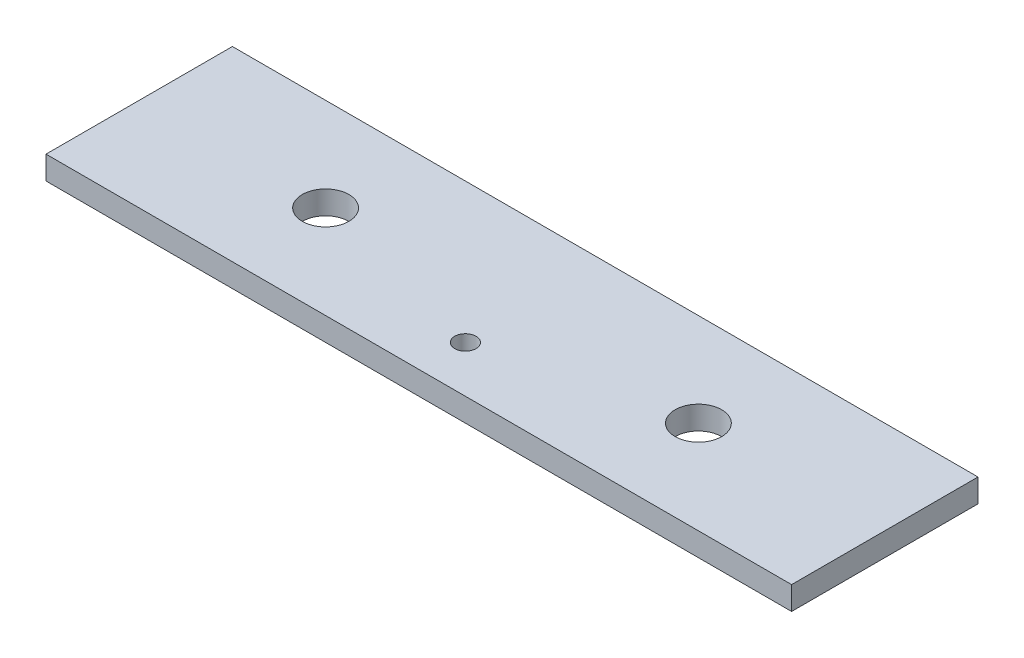
from build123d import *

# Parameters (mm, degrees)
SKETCH1_W           = 101.6
SKETCH1_H           = 25.4
BOSS_EXTRUDE1_DEPTH = 3.175
SKETCH2_R           = 1.4605
SKETCH2_R_2         = 3.175
CUT_EXTRUDE1_DEPTH  = 105.775


with BuildPart() as part:
    # Sketch1 → Boss-Extrude1 (new body)
    with BuildSketch(Plane(origin=(0, 0, 0), x_dir=(1, 0, 0), z_dir=(0, 1, 0))):
        with Locations((50.8, 12.7)):
            Rectangle(SKETCH1_W, SKETCH1_H)
    extrude(amount=BOSS_EXTRUDE1_DEPTH)

    # Sketch2 → Cut-Extrude1 (cut, through all)
    with BuildSketch(Plane(origin=(0, 3.175, 0), x_dir=(1, 0, 0), z_dir=(0, 1, 0))):
        with Locations(Location((50.8, 6.35, 0), (0, 0, 270))):
            Circle(SKETCH2_R)
        with Locations(Location((25.4, 12.7, 0), (0, 0, 270))):
            Circle(SKETCH2_R_2)
        with Locations(Location((76.2, 12.7, 0), (0, 0, 270))):
            Circle(SKETCH2_R_2)
    extrude(amount=-CUT_EXTRUDE1_DEPTH, mode=Mode.SUBTRACT)


solid = part.part
